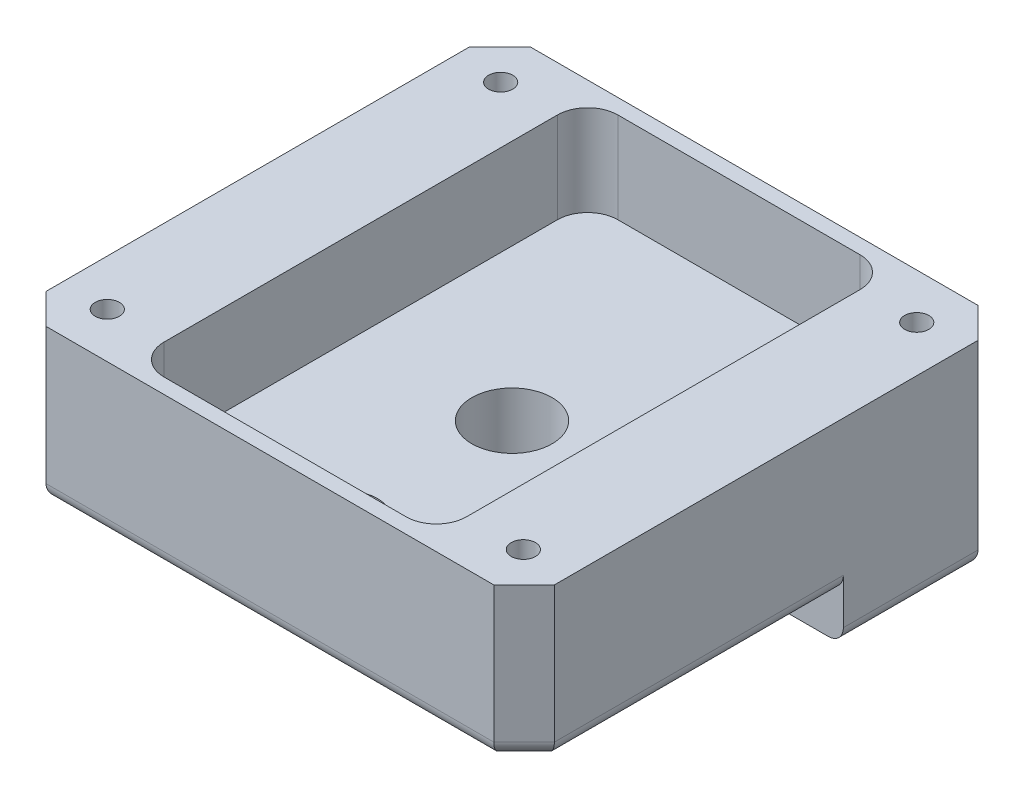
from build123d import *

# Parameters (mm, degrees)
SKIZZE1_W                          = 33.6
SKIZZE1_H                          = 32
AUFSATZ_LINEAR_AUSTRAGEN1_DEPTH    = 13
SKIZZE17_W                         = 20
SKIZZE17_H                         = 30
SCHNITT_LINEAR_AUSTRAGEN2_DEPTH    = 6
KERNLOCH_F_R_M2_GEWINDE1_D         = 1.6
VERRUNDUNG2_R                      = 2
DURCHGANGSLOCH_F_R_M52_D           = 5.3
F_3_0MM_CLEARANCE_STIFTLOCH1_D     = 3
F_3_0MM_CLEARANCE_STIFTLOCH1_DEPTH = 5
F_3_0MM_CLEARANCE_STIFTLOCH1_TIP   = 0.901290929
KERNLOCH_F_R_M5_GEWINDE1_D         = 4.2
SKIZZE27_W                         = 33.6
SKIZZE27_H                         = 21.1
SCHNITT_LINEAR_AUSTRAGEN3_DEPTH    = 3
FASE1_SIZE                         = 2
VERRUNDUNG3_R                      = 1


with BuildPart() as part:
    # Skizze1 → Aufsatz-Linear austragen1 (new body)
    with BuildSketch(Plane(origin=(0, 0, 0), x_dir=(1, 0, 0), z_dir=(0, 1, 0))):
        Rectangle(SKIZZE1_W, SKIZZE1_H)
    extrude(amount=AUFSATZ_LINEAR_AUSTRAGEN1_DEPTH)

    # Skizze17 → Schnitt-Linear austragen2 (cut)
    with BuildSketch(Plane(origin=(0, 13, 0), x_dir=(1, 0, 0), z_dir=(0, 1, 0))):
        Rectangle(SKIZZE17_W, SKIZZE17_H)
    extrude(amount=-SCHNITT_LINEAR_AUSTRAGEN2_DEPTH, mode=Mode.SUBTRACT)

    # Kernloch für M2 Gewinde1 (through all)
    with Locations(Plane(origin=(0, 13, 0), x_dir=(1, 0, 0), z_dir=(0, 1, 0))):
        with Locations((-13.75, 13), (13.75, 13), (13.75, -13), (-13.75, -13)):
            Hole(KERNLOCH_F_R_M2_GEWINDE1_D / 2)

    # Verrundung2
    verrundung2_edges = [part.edges().sort_by_distance(p)[0] for p in [
        (-10, 10, 15),
        (-10, 10, -15),
        (10, 10, -15),
        (10, 10, 15),
    ]]
    fillet(verrundung2_edges, radius=VERRUNDUNG2_R)

    # Durchgangsloch für M52 (through all)
    with Locations(Plane(origin=(0, 7, 0), x_dir=(1, 0, 0), z_dir=(0, 1, 0))):
        with Locations((0, 0)):
            Hole(DURCHGANGSLOCH_F_R_M52_D / 2)

    # Ø3.0mm Clearance Stiftloch1
    with Locations(Plane(origin=(0, 0, 0), x_dir=(-1, 0, 0), z_dir=(0, -1, 0))):
        with Locations((-9.5, 0)):
            Hole(F_3_0MM_CLEARANCE_STIFTLOCH1_D / 2, depth=F_3_0MM_CLEARANCE_STIFTLOCH1_DEPTH)
            with Locations((0, 0, -(F_3_0MM_CLEARANCE_STIFTLOCH1_DEPTH + F_3_0MM_CLEARANCE_STIFTLOCH1_TIP / 2))):  # 118° drill point
                Cone(0, F_3_0MM_CLEARANCE_STIFTLOCH1_D / 2, F_3_0MM_CLEARANCE_STIFTLOCH1_TIP, mode=Mode.SUBTRACT)

    # Kernloch für M5 Gewinde1 (through all)
    with Locations(Plane(origin=(0, 0, 0), x_dir=(-1, 0, 0), z_dir=(0, -1, 0))):
        with Locations((0, -11)):
            Hole(KERNLOCH_F_R_M5_GEWINDE1_D / 2)

    # Skizze27 → Schnitt-Linear austragen3 (cut)
    with BuildSketch(Plane.XZ):
        with Locations((0, 5.45)):
            Rectangle(SKIZZE27_W, SKIZZE27_H)
    extrude(amount=-SCHNITT_LINEAR_AUSTRAGEN3_DEPTH, mode=Mode.SUBTRACT)

    # Fase1
    fase1_edges = [part.edges().sort_by_distance(p)[0] for p in [
        (-16.8, 6.5, -16),
        (16.8, 6.5, -16),
        (16.8, 8, 16),
        (-16.8, 8, 16),
    ]]
    chamfer(fase1_edges, length=FASE1_SIZE)

    # Verrundung3
    verrundung3_edges = [part.edges().sort_by_distance(p)[0] for p in [
        (0, 3, 16),
        (-16.8, 3, 4.45),
        (15.8, 3, 15),
        (-15.8, 3, 15),
        (-16.8, 0, -9.55),
        (0, 0, -16),
        (-15.8, 0, -15),
        (15.8, 0, -15),
        (16.8, 0, -9.55),
        (16.8, 3, 4.45),
    ]]
    fillet(verrundung3_edges, radius=VERRUNDUNG3_R)


solid = part.part
